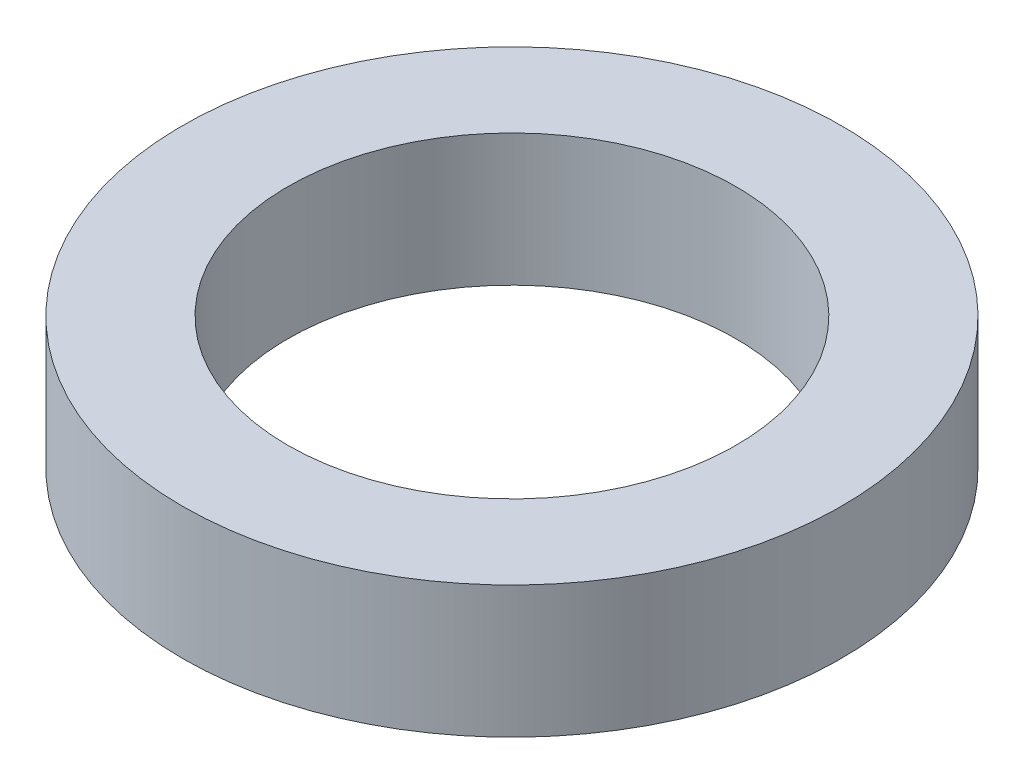
from build123d import *

# Parameters (mm, degrees)
ESQUISSE1_R        = 12.5
ESQUISSE1_R_2      = 8.5
BOSS_EXTRU_1_DEPTH = 5


with BuildPart() as part:
    # Esquisse1 → Boss.-Extru.1 (new body)
    with BuildSketch(Plane(origin=(0, 0, 0), x_dir=(1, 0, 0), z_dir=(0, 1, 0))):
        with Locations(Location((0, 0, 0), (0, 0, 270))):
            Circle(ESQUISSE1_R)
        with Locations(Location((0, 0, 0), (0, 0, 270))):
            Circle(ESQUISSE1_R_2, mode=Mode.SUBTRACT)
    extrude(amount=BOSS_EXTRU_1_DEPTH)


solid = part.part
